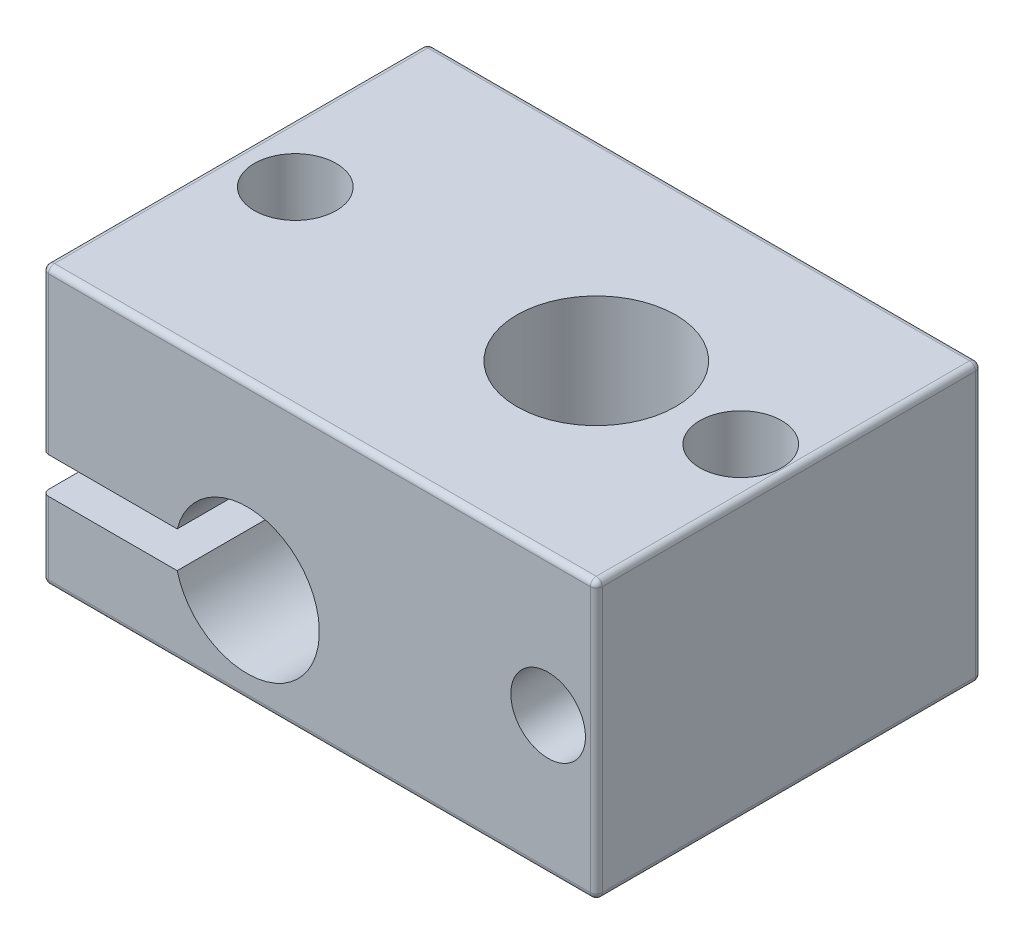
from build123d import *

# Parameters (mm, degrees)
SKETCH1_W            = 23
SKETCH1_H            = 16
BOSS_EXTRUDE1_DEPTH  = 11.5
M6_CLEARANCE_HOLE3_D = 6.6
M3_CLEARANCE_HOLE1_D = 3.4
SKETCH9_R            = 1.55
CUT_EXTRUDE1_DEPTH   = 23.814469093
FILLET1_R            = 0.25


with BuildPart() as part:
    # Sketch1 → Boss-Extrude1 (new body)
    with BuildSketch(Plane(origin=(0, 0, 0), x_dir=(1, 0, 0), z_dir=(0, 1, 0))):
        Rectangle(SKETCH1_W, SKETCH1_H)
    extrude(amount=BOSS_EXTRUDE1_DEPTH)

    # M6 Clearance Hole3 (through all)
    with Locations(Plane(origin=(0, 11.5, 0), x_dir=(1, 0, 0), z_dir=(0, 1, 0))):
        with Locations((3.5, 0)):
            Hole(M6_CLEARANCE_HOLE3_D / 2)

    # M3 Clearance Hole1 (through all)
    with Locations(Plane(origin=(0, 11.5, 0), x_dir=(1, 0, 0), z_dir=(0, 1, 0))):
        with Locations((-9, 0), (9.5, 0)):
            Hole(M3_CLEARANCE_HOLE1_D / 2)

    # Sketch9 → Cut-Extrude1 (cut, through all)
    with BuildSketch(Plane.XY.offset(8)):
        with BuildLine():
            ThreePointArc((-5.90473751, 3.25), (-6, 4), (-5.90473751, 4.75))
            Line((-5.90473751, 4.75), (-11.5, 4.75))
            Line((-11.5, 4.75), (-11.5, 3.25))
            Line((-11.5, 3.25), (-5.90473751, 3.25))
        make_face()
        with BuildLine():
            ThreePointArc((0, 4), (-2.621987123, 6.976089089), (-5.90473751, 4.75))
            Line((-5.90473751, 4.75), (-5.90473751, 3.25))
            ThreePointArc((-5.90473751, 3.25), (-2.621987123, 1.023910911), (0, 4))
        make_face()
        with BuildLine():
            Line((-5.90473751, 3.25), (-5.90473751, 4.75))
            ThreePointArc((-5.90473751, 4.75), (-6, 4), (-5.90473751, 3.25))
        make_face()
        with Locations((9.5, 5.75)):
            Circle(SKETCH9_R)
    extrude(amount=-CUT_EXTRUDE1_DEPTH, mode=Mode.SUBTRACT)

    # Fillet1
    fillet1_edges = [part.edges().sort_by_distance(p)[0] for p in [
        (-11.5, 11.5, 0),
        (0, 11.5, 8),
        (-11.5, 1.625, 8),
        (-11.5, 1.625, -8),
        (11.5, 11.5, 0),
        (0, 0, 8),
        (-11.5, 0, 0),
        (0, 0, -8),
        (11.5, 0, 0),
        (0, 11.5, -8),
        (11.5, 5.75, 8),
        (-11.5, 8.125, 8),
        (-11.5, 8.125, -8),
        (11.5, 5.75, -8),
    ]]
    fillet(fillet1_edges, radius=FILLET1_R)


solid = part.part
